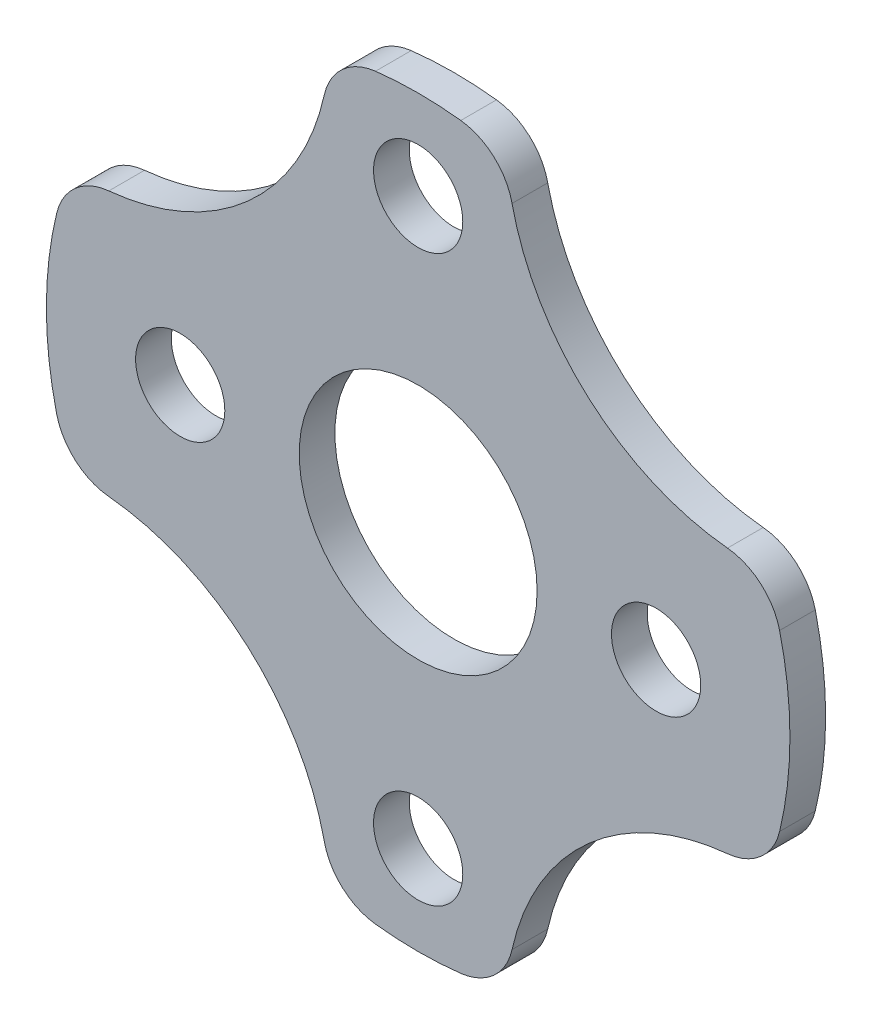
from build123d import *

# Parameters (mm, degrees)
CROQUIS1_R              = 12.5
CROQUIS1_R_2            = 1.5
CROQUIS1_R_3            = 4
SALIENTE_EXTRUIR1_DEPTH = 1.2
CORTAR_EXTRUIR1_DEPTH   = 10
REDONDEO1_R             = 2


with BuildPart() as part:
    # Croquis1 → Saliente-Extruir1 (new body)
    with BuildSketch(Plane.XY):
        with Locations((-62.749306062, 7.483862191)):
            Circle(CROQUIS1_R)
        with Locations((-70.749306062, 7.483862191)):
            Circle(CROQUIS1_R_2, mode=Mode.SUBTRACT)
        with Locations((-54.749306062, 7.483862191)):
            Circle(CROQUIS1_R_2, mode=Mode.SUBTRACT)
        with Locations((-62.749306062, 16.983862191)):
            Circle(CROQUIS1_R_2, mode=Mode.SUBTRACT)
        with Locations((-62.749306062, -2.016137809)):
            Circle(CROQUIS1_R_2, mode=Mode.SUBTRACT)
        with Locations((-62.749306062, 7.483862191)):
            Circle(CROQUIS1_R_3, mode=Mode.SUBTRACT)
    extrude(amount=SALIENTE_EXTRUIR1_DEPTH)

    # Croquis2 → Cortar-Extruir1 (cut)
    with BuildSketch(Plane(origin=(0, 0, 0), x_dir=(-1, 0, 0), z_dir=(0, 0, -1))):
        with BuildLine():
            ThreePointArc((74.439306062, 11.910361937), (71.035706773, 16.842578089), (65.727627737, 19.623862191))
            ThreePointArc((65.727627737, 19.623862191), (68.485948691, 13.962864407), (74.439306062, 11.910361937))
        make_face()
        with BuildLine():
            ThreePointArc((74.439306062, 3.057362445), (71.035706773, -1.874853707), (65.727627737, -4.656137809))
            ThreePointArc((65.727627737, -4.656137809), (68.485948691, 1.004859975), (74.439306062, 3.057362445))
        make_face()
        with BuildLine():
            ThreePointArc((51.059306062, 3.057362445), (54.462905352, -1.874853707), (59.770984387, -4.656137809))
            ThreePointArc((59.770984387, -4.656137809), (57.012663434, 1.004859975), (51.059306062, 3.057362445))
        make_face()
        with BuildLine():
            ThreePointArc((51.059306062, 11.910361937), (54.462905352, 16.842578089), (59.770984387, 19.623862191))
            ThreePointArc((59.770984387, 19.623862191), (57.012663434, 13.962864407), (51.059306062, 11.910361937))
        make_face()
    extrude(amount=-CORTAR_EXTRUIR1_DEPTH, mode=Mode.SUBTRACT)

    # Redondeo1
    redondeo1_edges = [part.edges().sort_by_distance(p)[0] for p in [
        (-59.770984387, 19.623862191, 0.6),
        (-51.059306062, 11.910361937, 0.6),
        (-74.439306062, 11.910361937, 0.6),
        (-65.727627737, 19.623862191, 0.6),
        (-65.727627737, -4.656137809, 0.6),
        (-74.439306062, 3.057362445, 0.6),
        (-51.059306062, 3.057362445, 0.6),
        (-59.770984387, -4.656137809, 0.6),
    ]]
    fillet(redondeo1_edges, radius=REDONDEO1_R)


solid = part.part
